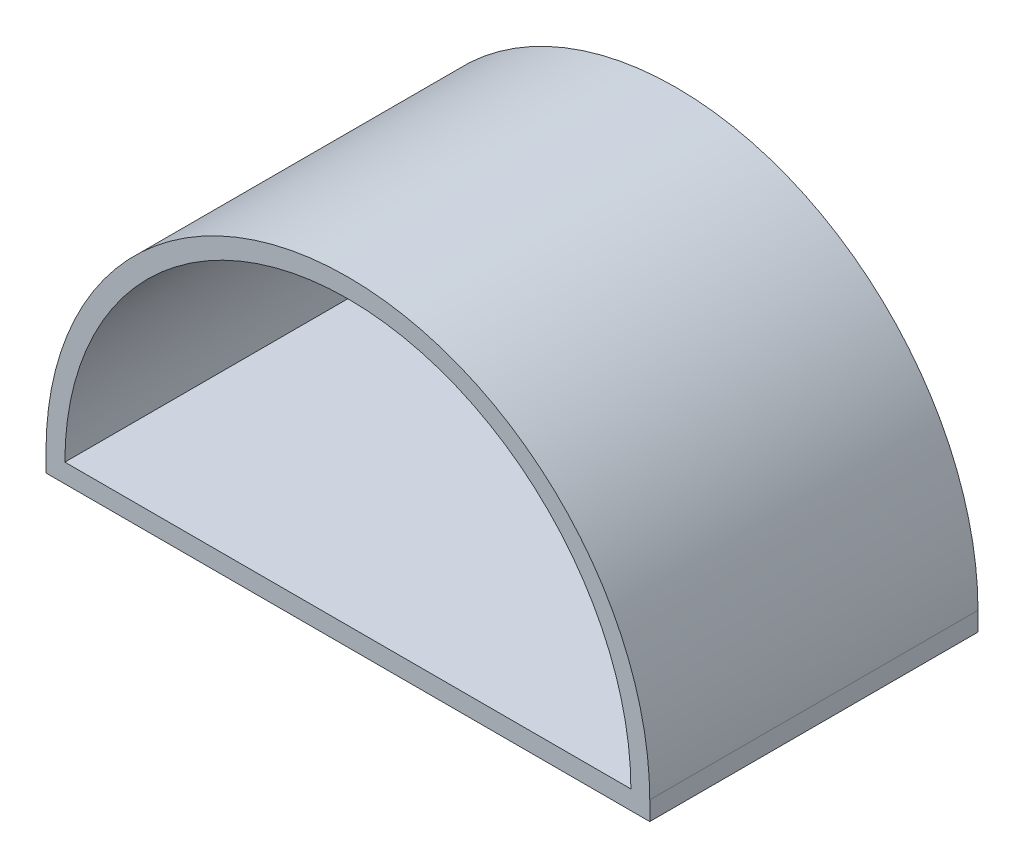
from build123d import *

# Parameters (mm, degrees)
EXTRUDE2_DEPTH = 110.49


with BuildPart() as part:
    # Sketch9 → Extrude2 (new body)
    with BuildSketch(Plane.XY):
        with BuildLine():
            ThreePointArc((-6.35, 0), (95.265102475, 101.615102475), (196.880204949, 0))
            Line((196.880204949, 0), (196.880204949, -6.35))
            Line((196.880204949, -6.35), (190.530204949, -6.35))
            Line((190.530204949, -6.35), (-6.35, -6.35))
            Line((-6.35, -6.35), (-6.35, 0))
        make_face()
        with BuildLine():
            Line((0, 0), (190.530204949, 0))
            ThreePointArc((190.530204949, 0), (95.265102475, 95.265102475), (0, 0))
        make_face(mode=Mode.SUBTRACT)
    extrude(amount=-EXTRUDE2_DEPTH)


solid = part.part
